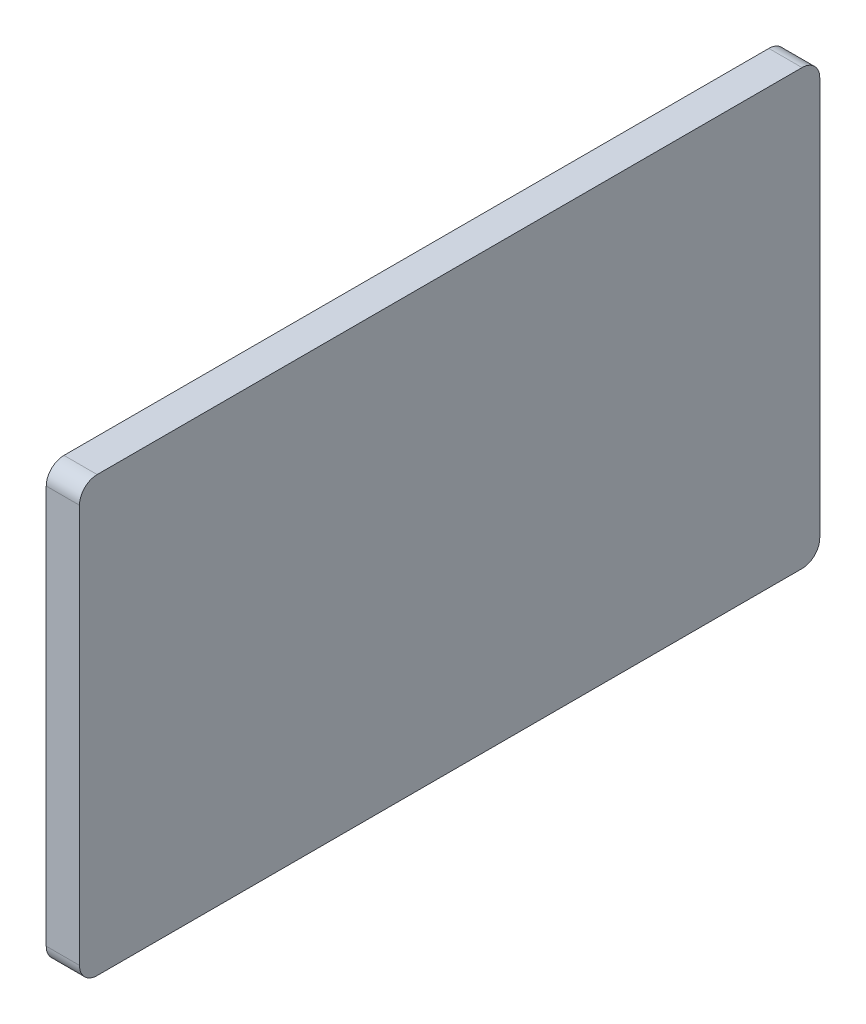
from build123d import *

# Parameters (mm, degrees)
SKETCH1_W           = 212.344
SKETCH1_H           = 124.46
BOSS_EXTRUDE1_DEPTH = 9.525
FILLET1_R           = 5.08


with BuildPart() as part:
    # Sketch1 → Boss-Extrude1 (new body)
    with BuildSketch(Plane(origin=(0, 0, 0), x_dir=(0, 0, -1), z_dir=(1, 0, 0))):
        Rectangle(SKETCH1_W, SKETCH1_H)
    extrude(amount=BOSS_EXTRUDE1_DEPTH)

    # Fillet1
    fillet1_edges = [part.edges().sort_by_distance(p)[0] for p in [
        (4.7625, -62.23, -106.172),
        (4.7625, -62.23, 106.172),
        (4.7625, 62.23, 106.172),
        (4.7625, 62.23, -106.172),
    ]]
    fillet(fillet1_edges, radius=FILLET1_R)


solid = part.part
